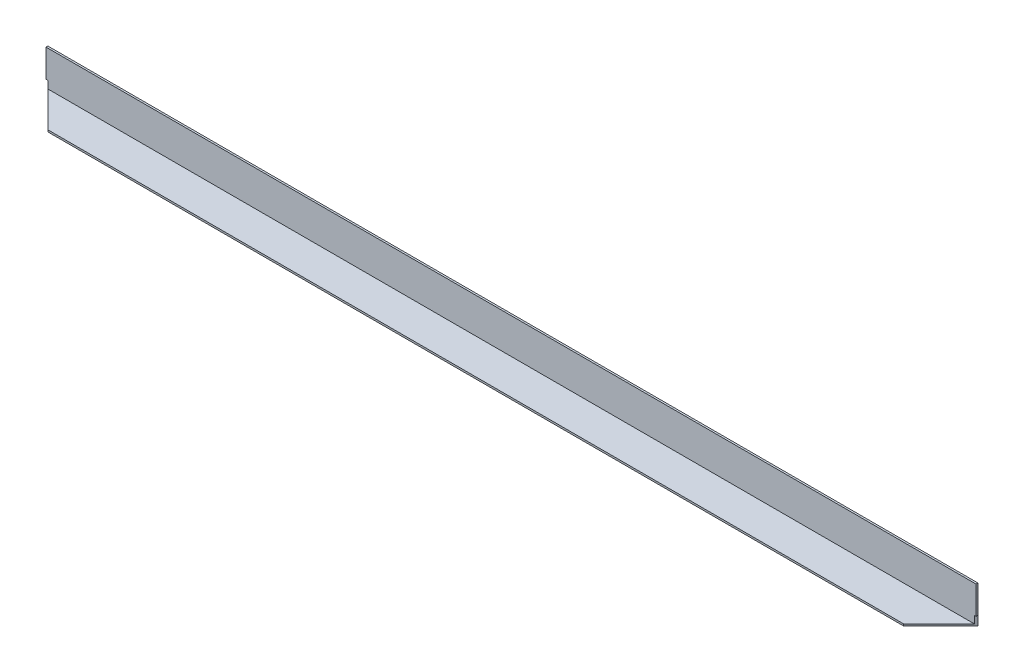
from build123d import *

# Parameters (mm, degrees)
SKETCH2_W           = 1000
SKETCH2_H           = 40
BOSS_EXTRUDE1_DEPTH = 40
SKETCH3_W           = 38
SKETCH3_H           = 38
CUT_EXTRUDE1_DEPTH  = 1004
CUT_EXTRUDE2_DEPTH  = 10


with BuildPart() as part:
    # Sketch2 → Boss-Extrude1 (new body)
    with BuildSketch(Plane.XY):
        with Locations((151.125401929, 46.720257235)):
            Rectangle(SKETCH2_W, SKETCH2_H)
    extrude(amount=BOSS_EXTRUDE1_DEPTH)

    # Sketch3 → Cut-Extrude1 (cut)
    with BuildSketch(Plane.ZY.offset(348.874598071)):
        with Locations((21, 47.720257235)):
            Rectangle(SKETCH3_W, SKETCH3_H)
    extrude(amount=-CUT_EXTRUDE1_DEPTH, mode=Mode.SUBTRACT)

    # Sketch4 → Cut-Extrude2 (cut)
    with BuildSketch(Plane(origin=(0, 26.720257235, 0), x_dir=(-1, 0, 0), z_dir=(0, -1, 0))):
        Polygon((-651.125401929, 0), (-651.125401929, -40), (-611.125401929, -40), align=None)
        Polygon((348.874598071, 0), (308.874598071, -40), (348.874598071, -40), align=None)
    extrude(amount=-CUT_EXTRUDE2_DEPTH, mode=Mode.SUBTRACT)


solid = part.part
